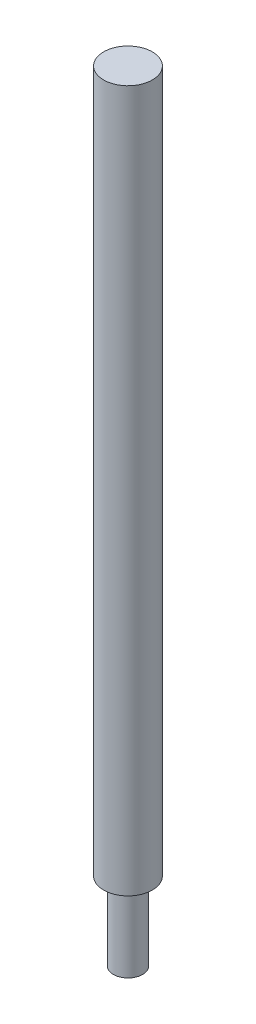
from build123d import *

# Parameters (mm, degrees)
SKETCH1_R           = 1.5
BOSS_EXTRUDE1_DEPTH = 8
SKETCH2_R           = 2.5
BOSS_EXTRUDE2_DEPTH = 72


with BuildPart() as part:
    # Sketch1 → Boss-Extrude1 (new body)
    with BuildSketch(Plane(origin=(0, 0, 0), x_dir=(1, 0, 0), z_dir=(0, 1, 0))):
        with Locations(Location((0, 0, 0), (0, 0, 270))):
            Circle(SKETCH1_R)
    extrude(amount=BOSS_EXTRUDE1_DEPTH)

    # Sketch2 → Boss-Extrude2 (add)
    with BuildSketch(Plane(origin=(0, 8, 0), x_dir=(1, 0, 0), z_dir=(0, 1, 0))):
        with Locations(Location((0, 0, 0), (0, 0, 270))):
            Circle(SKETCH2_R)
    extrude(amount=BOSS_EXTRUDE2_DEPTH)


solid = part.part
